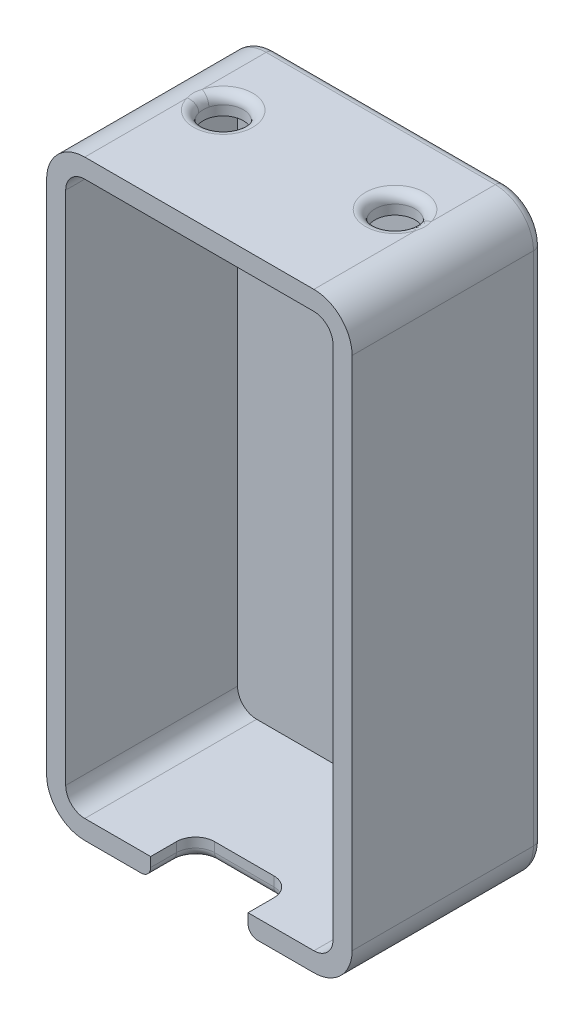
from build123d import *

# Parameters (mm, degrees)
SKETCH1_W             = 32
SKETCH1_H             = 62
BOSS_EXTRUDE4_DEPTH   = 2
SKETCH2_W             = 32
SKETCH2_H             = 62
SKETCH2_W_2           = 28
SKETCH2_H_2           = 58
BOSS_EXTRUDE5_DEPTH   = 18
SKETCH3_R             = 2.1
CUT_EXTRUDE1_DEPTH    = 10
SKETCH5_W             = 10.2
SKETCH5_H             = 4.7
CUT_EXTRUDE2_DEPTH    = 2
FILLET13_R            = 2
FILLET14_R            = 4
FILLET15_R            = 1
BODY_MOVE_COPY1_ANGLE = 180


with BuildPart() as part:
    # Sketch1 → Boss-Extrude4 (new body)
    with BuildSketch(Plane.XY):
        Rectangle(SKETCH1_W, SKETCH1_H)
    extrude(amount=BOSS_EXTRUDE4_DEPTH)

    # Sketch2 → Boss-Extrude5 (add)
    with BuildSketch(Plane.XY):
        Rectangle(SKETCH2_W, SKETCH2_H)
        Rectangle(SKETCH2_W_2, SKETCH2_H_2, mode=Mode.SUBTRACT)
    extrude(amount=-BOSS_EXTRUDE5_DEPTH)

    # Sketch3 → Cut-Extrude1 (cut)
    with BuildSketch(Plane(origin=(0, 31, 0), x_dir=(1, 0, 0), z_dir=(0, 1, 0))):
        with Locations(Location((-9, 6.5, 0), (0, 0, 270))):
            Circle(SKETCH3_R)
        with Locations(Location((9, 6.5, 0), (0, 0, 270))):
            Circle(SKETCH3_R)
    extrude(amount=-CUT_EXTRUDE1_DEPTH, mode=Mode.SUBTRACT)

    # Sketch5 → Cut-Extrude2 (cut)
    with BuildSketch(Plane.XZ.offset(31)):
        with Locations((0, -15.65)):
            Rectangle(SKETCH5_W, SKETCH5_H)
    extrude(amount=-CUT_EXTRUDE2_DEPTH, mode=Mode.SUBTRACT)

    # Fillet13
    fillet13_edges = [part.edges().sort_by_distance(p)[0] for p in [
        (14, 29, -9),
        (-14, 29, -9),
        (-14, -29, -9),
        (14, -29, -9),
        (-5.1, -30, -13.3),
        (5.1, -30, -13.3),
    ]]
    fillet(fillet13_edges, radius=FILLET13_R)

    # Fillet14
    fillet14_edges = [part.edges().sort_by_distance(p)[0] for p in [
        (16, -31, -8),
        (-16, -31, -8),
        (-16, 31, -8),
        (16, 31, -8),
    ]]
    fillet(fillet14_edges, radius=FILLET14_R)

    # Fillet15
    fillet15_edges = [part.edges().sort_by_distance(p)[0] for p in [
        (16, 0, 2),
        (0, -31, 2),
        (0, 31, 2),
        (-16, 0, 2),
        (-14.828427125, -29.828427125, 2),
        (-14.828427125, 29.828427125, 2),
        (14.828427125, 29.828427125, 2),
        (14.828427125, -29.828427125, 2),
        (-9, 31, -8.6),
        (9, 31, -8.6),
        (5.1, -31, -16.65),
        (-5.1, -31, -16.65),
        (0, -31, -13.3),
        (-4.514213562, -31, -13.885786438),
        (4.514213562, -31, -13.885786438),
    ]]
    fillet(fillet15_edges, radius=FILLET15_R)


with BuildPart() as part_1:
    # Body-Move/Copy1: moved
    add(part.part.rotate(Axis((0, 0, -8), (0, 1, 0)), BODY_MOVE_COPY1_ANGLE))


solid = part_1.part
